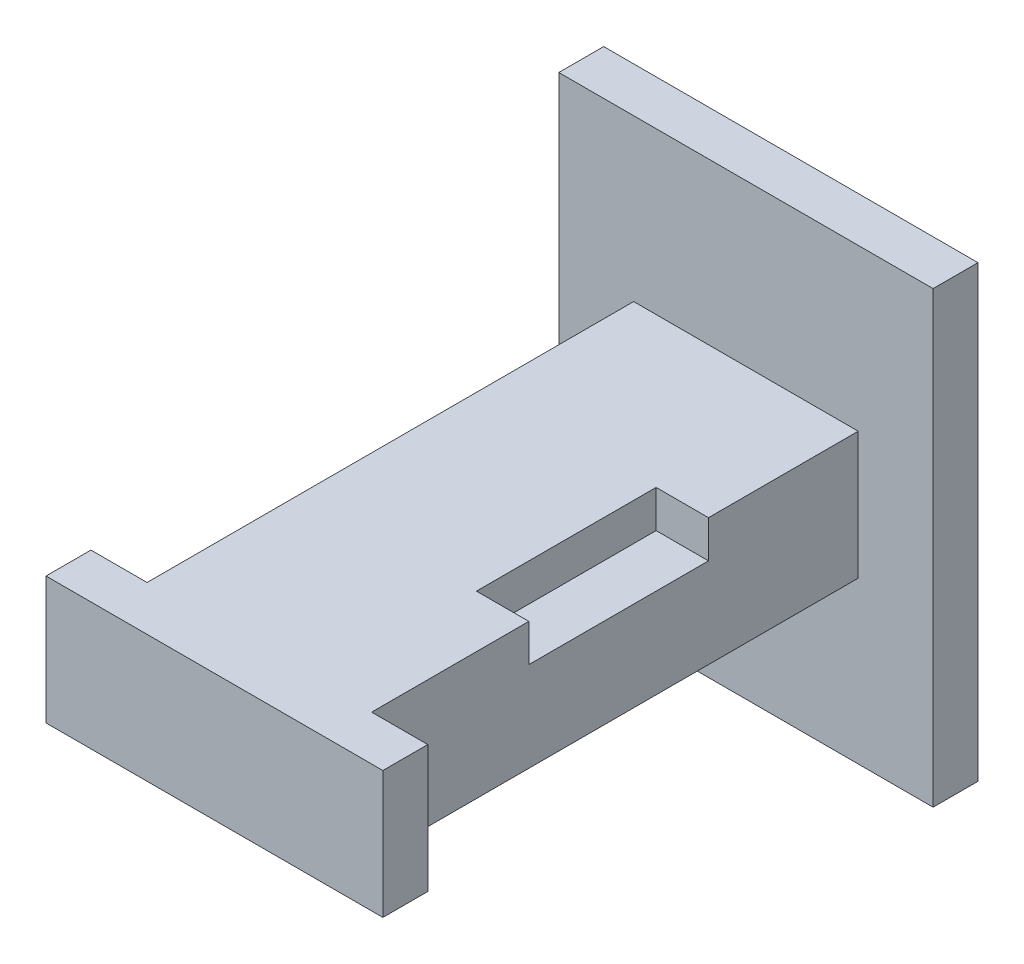
from build123d import *

# Parameters (mm, degrees)
SKETCH_1_W          = 50
SKETCH_1_H          = 60
EXTRUDE_1_DEPTH     = 6
SKETCH_2_W          = 30
SKETCH_2_H          = 17
EXTRUDE_2_DEPTH     = 65
SKETCH_3_W          = 45
SKETCH_3_H          = 30
EXTRUDE_3_DEPTH     = 6
SKETCH_4_W          = 18
SKETCH_4_H          = 13
CUT_EXTRUDE_1_DEPTH = 10
SKETCH_5_W          = 24
SKETCH_5_H          = 5
CUT_EXTRUDE_2_DEPTH = 7
SKETCH_6_W          = 45
SKETCH_6_H          = 6
CUT_EXTRUDE_3_DEPTH = 6.5
SKETCH_7_W          = 45
SKETCH_7_H          = 6
CUT_EXTRUDE_4_DEPTH = 6.5


with BuildPart() as part:
    # Эскиз1 → Бобышка-Вытянуть1 (new body)
    with BuildSketch(Plane.XY):
        Rectangle(SKETCH_1_W, SKETCH_1_H)
    extrude(amount=EXTRUDE_1_DEPTH)

    # Эскиз2 → Бобышка-Вытянуть2 (add)
    with BuildSketch(Plane.XY.offset(6)):
        Rectangle(SKETCH_2_W, SKETCH_2_H)
    extrude(amount=EXTRUDE_2_DEPTH)

    # Эскиз3 → Бобышка-Вытянуть3 (add)
    with BuildSketch(Plane.XY.offset(71)):
        Rectangle(SKETCH_3_W, SKETCH_3_H)
    extrude(amount=EXTRUDE_3_DEPTH)

    # Эскиз4 → Вырез-Вытянуть1 (cut)
    with BuildSketch(Plane.ZY.offset(15)):
        with Locations((42, -2)):
            Rectangle(SKETCH_4_W, SKETCH_4_H)
    extrude(amount=-CUT_EXTRUDE_1_DEPTH, mode=Mode.SUBTRACT)

    # Эскиз5 → Вырез-Вытянуть2 (cut)
    with BuildSketch(Plane(origin=(15, 0, 0), x_dir=(0, 0, -1), z_dir=(1, 0, 0))):
        with Locations((-38, 6)):
            Rectangle(SKETCH_5_W, SKETCH_5_H)
    extrude(amount=-CUT_EXTRUDE_2_DEPTH, mode=Mode.SUBTRACT)

    # Эскиз6 → Вырез-Вытянуть3 (cut)
    with BuildSketch(Plane(origin=(0, 15, 0), x_dir=(1, 0, 0), z_dir=(0, 1, 0))):
        with Locations((0, -74)):
            Rectangle(SKETCH_6_W, SKETCH_6_H)
    extrude(amount=-CUT_EXTRUDE_3_DEPTH, mode=Mode.SUBTRACT)

    # Эскиз7 → Вырез-Вытянуть4 (cut)
    with BuildSketch(Plane.XZ.offset(15)):
        with Locations((0, 74)):
            Rectangle(SKETCH_7_W, SKETCH_7_H)
    extrude(amount=-CUT_EXTRUDE_4_DEPTH, mode=Mode.SUBTRACT)


solid = part.part
